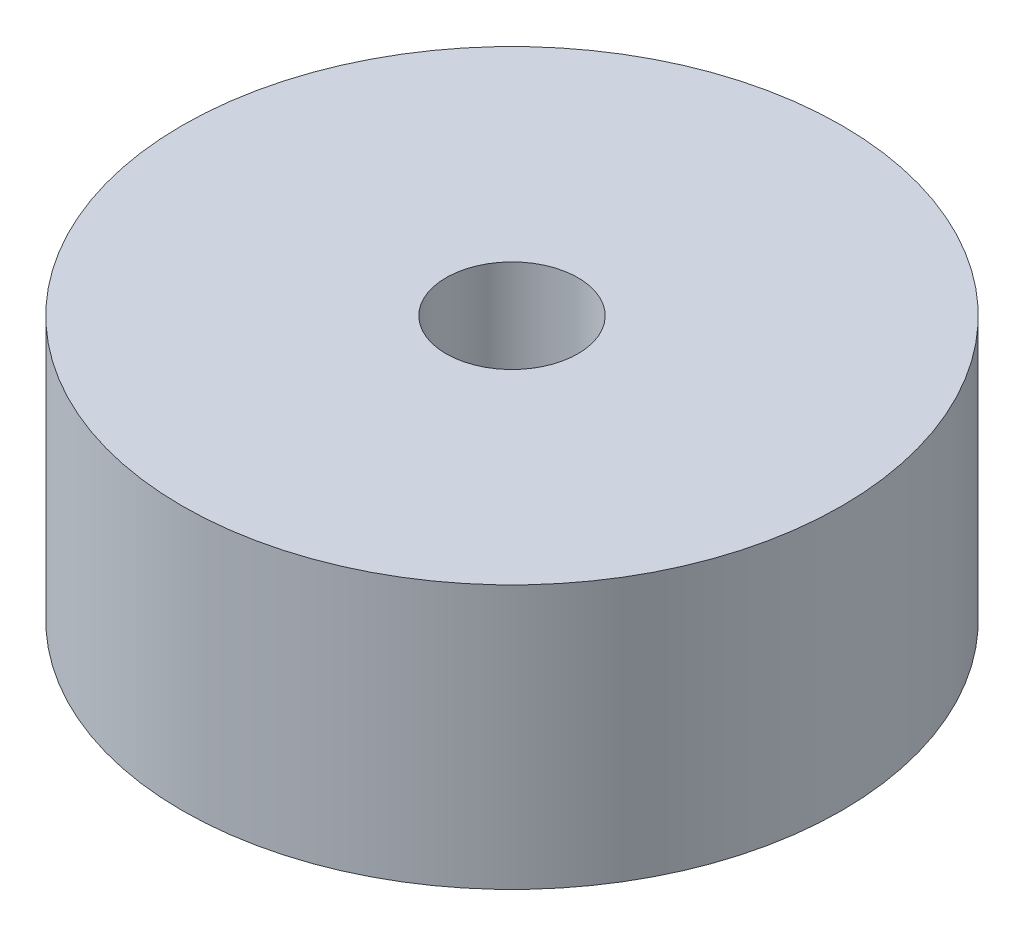
from build123d import *

# Parameters (mm, degrees)
ESQUISSE1_R      = 15
EXTRUSION1_DEPTH = 12
ESQUISSE2_R      = 3
EXTRUSION2_DEPTH = 25.372115214


with BuildPart() as part:
    # Esquisse1 → Extrusion1 (new body)
    with BuildSketch(Plane(origin=(0, 0, 0), x_dir=(1, 0, 0), z_dir=(0, 1, 0))):
        with Locations(Location((0, 0, 0), (0, 0, 270))):
            Circle(ESQUISSE1_R)
    extrude(amount=EXTRUSION1_DEPTH)

    # Esquisse2 → Extrusion2 (cut, through all)
    with BuildSketch(Plane(origin=(0, 12, 0), x_dir=(-1, 0, 0), z_dir=(0, 1, 0))):
        with Locations(Location((0, 0, 0), (0, 0, 90))):
            Circle(ESQUISSE2_R)
    extrude(amount=-EXTRUSION2_DEPTH, mode=Mode.SUBTRACT)


solid = part.part
